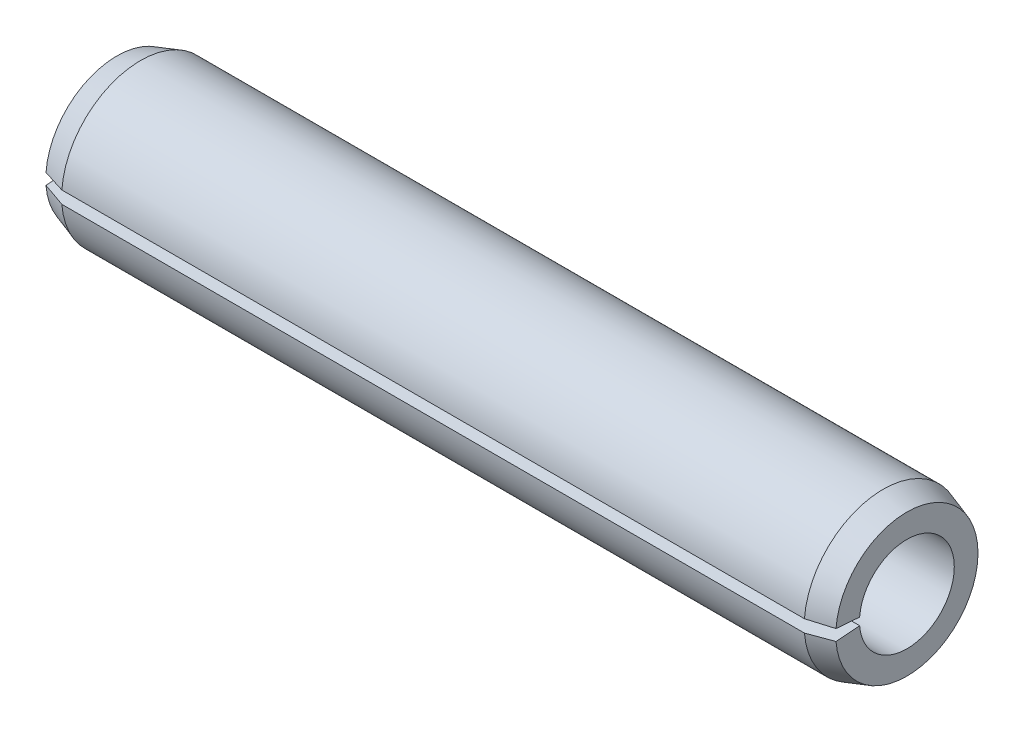
from build123d import *

# Parameters (mm, degrees)
GAP_DEPTH = 11.099504938


with BuildPart() as part:
    # BodySke → Body (revolve)
    with BuildSketch(Plane.XY, mode=Mode.PRIVATE) as body_sk:
        Polygon((0, 0.6), (10, 0.6), (10, 0.9), (9.7, 1), (0.3, 1), (0, 0.9), align=None)
    revolve(body_sk.sketch.rotate(Axis((-9.525, 0, 0), (1, 0, 0)), 90), axis=Axis((-9.525, 0, 0), (1, 0, 0)))

    # GapSke → Gap (cut, through all)
    with BuildSketch(Plane(origin=(0, 0, 0), x_dir=(0, -1, 0), z_dir=(-1, 0, 0))):
        with BuildLine():
            Line((0, 0), (0.080028278, 1.01685568))
            ThreePointArc((0.080028278, 1.01685568), (0, 1.02), (-0.080028278, 1.01685568))
            Line((-0.080028278, 1.01685568), (0, 0))
        make_face()
    extrude(amount=-GAP_DEPTH, mode=Mode.SUBTRACT)


solid = part.part
